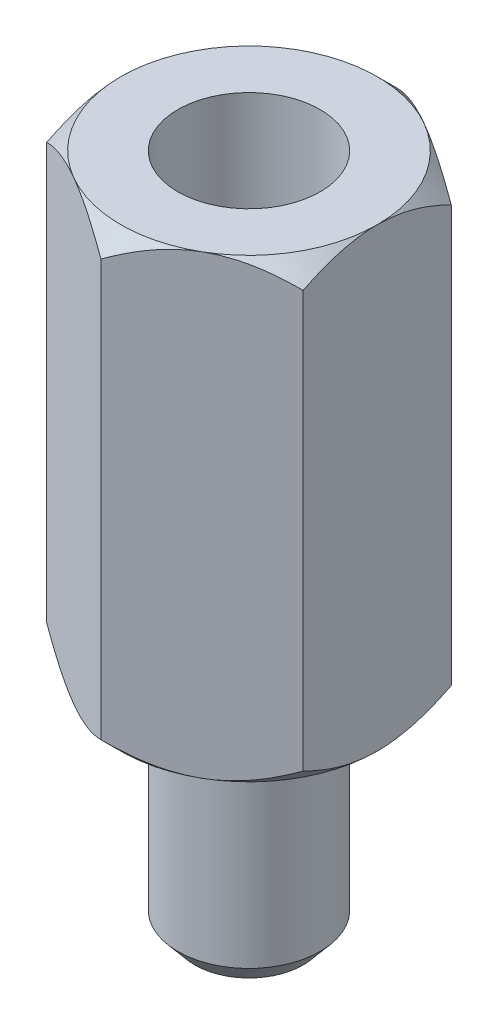
from build123d import *

# Parameters (mm, degrees)
SKETCH1_R           = 1.25
BOSS_EXTRUDE1_DEPTH = 3.9
BOSS_EXTRUDE2_DEPTH = 8
CUT_EXTRUDE1_START  = -4.8
SKETCH3_R           = 1.25
CUT_EXTRUDE1_DEPTH  = 4.8
SKETCH5_OUTSIDE_W   = 36.022
SKETCH5_OUTSIDE_H   = 36.718
SKETCH5_OUTSIDE_R   = 2.25
CUT_EXTRUDE2_DEPTH  = 13.386383653
CUT_EXTRUDE2_DRAFT  = -45
SKETCH6_OUTSIDE_W   = 28.662
SKETCH6_OUTSIDE_H   = 29.358
SKETCH6_OUTSIDE_R   = 2.25
CUT_EXTRUDE3_DEPTH  = 9.707037384
CUT_EXTRUDE3_DRAFT  = -45
CHAMFER1_SIZE       = 0.3
CHAMFER1_SIZE2      = 0.357526078


with BuildPart() as part:
    # Sketch1 → Boss-Extrude1 (new body)
    with BuildSketch(Plane(origin=(0, 0, 0), x_dir=(1, 0, 0), z_dir=(0, 1, 0))):
        with Locations(Location((0, 0, 0), (0, 0, 270))):
            Circle(SKETCH1_R)
    extrude(amount=BOSS_EXTRUDE1_DEPTH)

    # Sketch2 → Boss-Extrude2 (add)
    with BuildSketch(Plane(origin=(0, 3.9, 0), x_dir=(1, 0, 0), z_dir=(0, 1, 0))):
        Polygon((-2.25, 1.299038106), (-2.25, -1.299038106), (0, -2.598076211), (2.25, -1.299038106), (2.25, 1.299038106), (0, 2.598076211), align=None)
    extrude(amount=BOSS_EXTRUDE2_DEPTH)

    # Sketch3 → Cut-Extrude1 (cut)
    with BuildSketch(Plane(origin=(0, 11.9, 0), x_dir=(1, 0, 0), z_dir=(0, 1, 0)).offset(CUT_EXTRUDE1_START)):
        with Locations(Location((0, 0, 0), (0, 0, 270))):
            Circle(SKETCH3_R)
    extrude(amount=CUT_EXTRUDE1_DEPTH, mode=Mode.SUBTRACT)


with BuildPart() as cut_extrude2_tool:
    # Sketch5 outside → Cut-Extrude2 (with draft: the straight prism first)
    with BuildSketch(Plane(origin=(0, 11.9, 0), x_dir=(1, 0, 0), z_dir=(0, 1, 0))):
        Rectangle(SKETCH5_OUTSIDE_W, SKETCH5_OUTSIDE_H)
        Circle(SKETCH5_OUTSIDE_R, mode=Mode.SUBTRACT)
    extrude(amount=-CUT_EXTRUDE2_DEPTH)
    # Cut-Extrude2: the draft: its side faces are tilted about the plane it starts from
    cut_extrude2_sides = [cut_extrude2_tool.faces().sort_by_distance(p)[0] for p in [
        (0, 5.206808173, 18.359),
        (18.011, 5.206808173, 0),
        (0, 5.206808173, -18.359),
        (-18.011, 5.206808173, 0),
        (-2.25, 5.206808173, 0),
    ]]
    draft(cut_extrude2_sides, Plane(origin=(0, 11.9, 0), x_dir=(1, 0, 0), z_dir=(0, 1, 0)), CUT_EXTRUDE2_DRAFT)


with BuildPart() as part_1:
    add(part.part)

    # Cut-Extrude2: cut by cut_extrude2_tool
    add(cut_extrude2_tool.part, mode=Mode.SUBTRACT)


with BuildPart() as cut_extrude3_tool:
    # Sketch6 outside → Cut-Extrude3 (with draft: the straight prism first)
    with BuildSketch(Plane.XZ.offset(-3.9)):
        Rectangle(SKETCH6_OUTSIDE_W, SKETCH6_OUTSIDE_H)
        Circle(SKETCH6_OUTSIDE_R, mode=Mode.SUBTRACT)
    extrude(amount=-CUT_EXTRUDE3_DEPTH)
    # Cut-Extrude3: the draft: its side faces are tilted about the plane it starts from
    cut_extrude3_sides = [cut_extrude3_tool.faces().sort_by_distance(p)[0] for p in [
        (0, 8.753518692, -14.679),
        (14.331, 8.753518692, 0),
        (0, 8.753518692, 14.679),
        (-14.331, 8.753518692, 0),
        (-2.25, 8.753518692, 0),
    ]]
    draft(cut_extrude3_sides, Plane.XZ.offset(-3.9), CUT_EXTRUDE3_DRAFT)


with BuildPart() as part_2:
    add(part_1.part)

    # Cut-Extrude3: cut by cut_extrude3_tool
    add(cut_extrude3_tool.part, mode=Mode.SUBTRACT)

    # Chamfer1
    chamfer1_edges = [part_2.edges().sort_by_distance(p)[0] for p in [
        (0, 0, -1.25),
    ]]
    chamfer1_side = [part_2.faces().sort_by_distance(p)[0] for p in [
        (0, 0, 0),
    ]]
    chamfer(chamfer1_edges, length=CHAMFER1_SIZE, length2=CHAMFER1_SIZE2, reference=chamfer1_side[0])


solid = part_2.part
